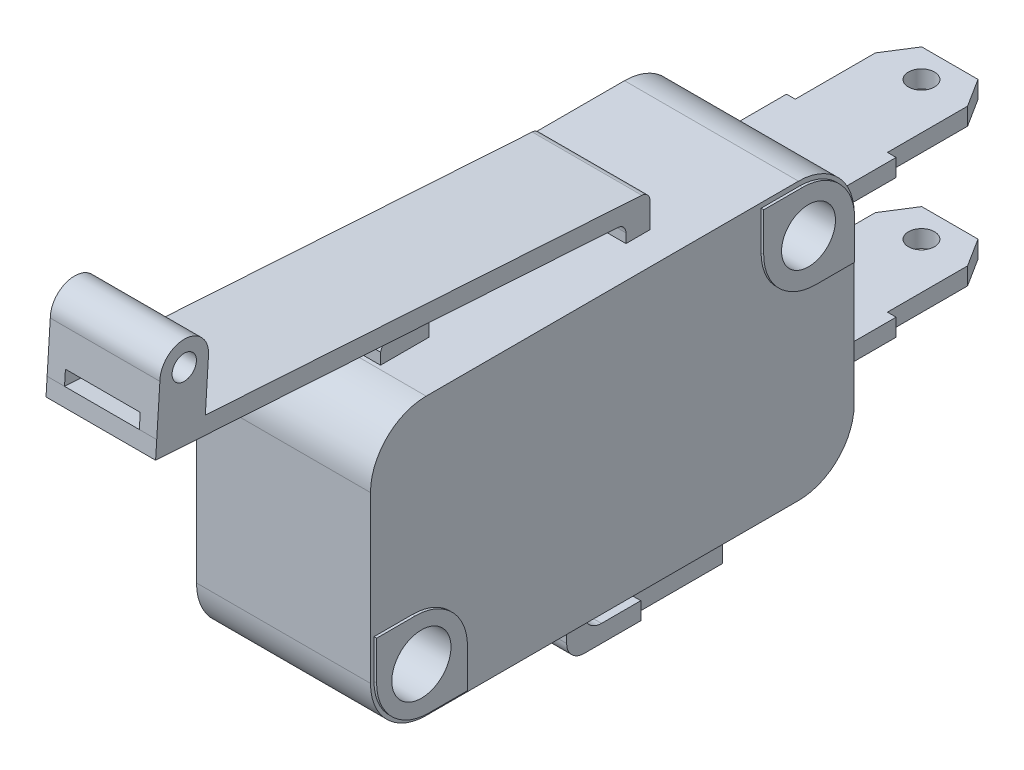
from build123d import *
from OCP.BRepFilletAPI import BRepFilletAPI_MakeChamfer

# Parameters (mm, degrees)
BOSS_EXTRUDE1_DEPTH        = 4.3
BOSS_EXTRUDE2_DEPTH        = 1
BOSS_EXTRUDE3_START        = 1
BOSS_EXTRUDE3_DEPTH        = 1
CUT_EXTRUDE1_DEPTH         = 4.3
SKETCH5_W                  = 1.380694599
SKETCH5_H                  = 0.913887033
BOSS_EXTRUDE4_DEPTH        = 1.85
SKETCH6_W                  = 8.15
SKETCH6_H                  = 1.380694599
BOSS_EXTRUDE5_DEPTH        = 16.905731032
SKETCH7_W                  = 8.15
SKETCH7_H                  = 17.819618065
BOSS_EXTRUDE6_DEPTH        = 9.886282081
CUT_EXTRUDE2_DEPTH         = 0.913887033
CUT_EXTRUDE3_DEPTH         = 1.005731032
SKETCH10_W                 = 8.15
SKETCH10_H                 = 15.9
BOSS_EXTRUDE7_DEPTH        = 16.53302332
SKETCH11_W                 = 27.8
SKETCH11_H                 = 15.9
BOSS_EXTRUDE8_DEPTH        = 1.85
SKETCH12_W                 = 6.3
SKETCH12_H                 = 1
BOSS_EXTRUDE9_DEPTH        = 3.3
SKETCH13_W                 = 6.3
SKETCH13_H                 = 1
BOSS_EXTRUDE10_DEPTH       = 9.5
SKETCH14_W                 = 0.5
SKETCH14_H                 = 6.238763167
CUT_EXTRUDE4_DEPTH         = 37.103920655
SKETCH15_W                 = 0.5
SKETCH15_H                 = 6.238763167
CUT_EXTRUDE5_DEPTH         = 37.103920655
SKETCH16_W                 = 6.3
SKETCH16_H                 = 1
BOSS_EXTRUDE11_DEPTH       = 10.5
SKETCH17_W                 = 0.5
SKETCH17_H                 = 6.238763167
CUT_EXTRUDE6_DEPTH         = 29.934160174
SKETCH18_W                 = 0.5
SKETCH18_H                 = 6.238763167
CUT_EXTRUDE7_DEPTH         = 29.934160174
SKETCH19_W                 = 6.3
SKETCH19_H                 = 1
BOSS_EXTRUDE12_DEPTH       = 10.5
SKETCH20_W                 = 0.5
SKETCH20_H                 = 6.238763167
CUT_EXTRUDE8_DEPTH         = 33.170848621
SKETCH21_W                 = 0.5
SKETCH21_H                 = 6.238763167
CUT_EXTRUDE9_DEPTH         = 33.170848621
SKETCH22_W                 = 5.225
SKETCH22_H                 = 5.225
BOSS_EXTRUDE13_DEPTH       = 0.15
SKETCH23_W                 = 5.225
SKETCH23_H                 = 5.225
BOSS_EXTRUDE14_DEPTH       = 0.15
BOSS_EXTRUDE15_DEPTH       = 4.3
SKETCH25_W                 = 5.225
SKETCH25_H                 = 5.225
BOSS_EXTRUDE16_DEPTH       = 0.15
SKETCH26_W                 = 5.225
SKETCH26_H                 = 5.225
BOSS_EXTRUDE17_DEPTH       = 0.15
F_00_CLEARANCE_HOLE1_D     = 1.5
F_00_CLEARANCE_HOLE1_DEPTH = 1
F_00_CLEARANCE_HOLE2_D     = 1.5
F_00_CLEARANCE_HOLE2_DEPTH = 15.725
F_4_CLEARANCE_HOLE1_D      = 3.1
F_4_CLEARANCE_HOLE2_D      = 3.4
F_00_CLEARANCE_HOLE3_D     = 1.5
F_00_CLEARANCE_HOLE3_DEPTH = 1
F_00_CLEARANCE_HOLE4_D     = 1.4
F_00_CLEARANCE_HOLE4_DEPTH = 1
F_00_CLEARANCE_HOLE5_D     = 1.4
F_00_CLEARANCE_HOLE5_DEPTH = 1
CHAMFER1_SIZE              = 1.632857048
CHAMFER1_SIZE2             = 1.033032958
CHAMFER2_SIZE              = 1.033032958
CHAMFER2_SIZE2             = 1.632857048
CHAMFER3_SIZE              = 1.632857048
CHAMFER3_SIZE2             = 1.033032958
FILLET1_R                  = 0.5
FILLET2_R                  = 1
FILLET3_R                  = 3
FILLET4_R                  = 3.2


with BuildPart() as part:
    # Sketch1 → Boss-Extrude1 (new body)
    with BuildSketch(Plane(origin=(2.15, 0, 0), x_dir=(0, 0, -1), z_dir=(1, 0, 0))):
        with BuildLine():
            Line((2.63302332, 8.955731032), (4.013717919, 8.955731032))
            Line((4.013717919, 8.955731032), (4.013717919, 9.869618065))
            Line((4.013717919, 9.869618065), (-21.541974901, 11.501192936))
            Line((-21.541974901, 11.501192936), (-21.354211514, 14.486814776))
            ThreePointArc((-21.354211514, 14.486814776), (-22.754211514, 15.886814776), (-24.154211514, 14.486814776))
            Line((-24.154211514, 14.486814776), (-24.336285828, 11.679592619))
            Line((-24.336285828, 11.679592619), (-24.4, 10.681624431))
            Line((-24.4, 10.681624431), (2.63302332, 8.955731032))
        make_face()
    extrude(amount=-BOSS_EXTRUDE1_DEPTH)

    # Sketch2 → Boss-Extrude2 (add)
    with BuildSketch(Plane.ZY.offset(2.15)):
        with BuildLine():
            Line((-2.63302332, 8.955731032), (-4.013717919, 8.955731032))
            Line((-4.013717919, 8.955731032), (-4.013717919, 9.869618065))
            Line((-4.013717919, 9.869618065), (21.541974901, 11.501192936))
            Line((21.541974901, 11.501192936), (21.354211514, 14.486814776))
            ThreePointArc((21.354211514, 14.486814776), (22.754211514, 15.886814776), (24.154211514, 14.486814776))
            Line((24.154211514, 14.486814776), (24.336285828, 11.679592619))
            Line((24.336285828, 11.679592619), (24.4, 10.681624431))
            Line((24.4, 10.681624431), (-2.63302332, 8.955731032))
        make_face()
    extrude(amount=BOSS_EXTRUDE2_DEPTH)

    # Sketch3 → Boss-Extrude3 (add)
    with BuildSketch(Plane(origin=(2.15, 0, 0), x_dir=(0, 0, -1), z_dir=(1, 0, 0)).offset(BOSS_EXTRUDE3_START)):
        with BuildLine():
            Line((4.013717919, 8.955731032), (2.63302332, 8.955731032))
            Line((2.63302332, 8.955731032), (-24.4, 10.681624431))
            Line((-24.4, 10.681624431), (-24.336285828, 11.679592619))
            Line((-24.336285828, 11.679592619), (-24.154211514, 14.486814776))
            ThreePointArc((-24.154211514, 14.486814776), (-22.754211514, 15.886814776), (-21.354211514, 14.486814776))
            Line((-21.354211514, 14.486814776), (-21.541974901, 11.501192936))
            Line((-21.541974901, 11.501192936), (4.013717919, 9.869618065))
            Line((4.013717919, 9.869618065), (4.013717919, 8.955731032))
        make_face()
    extrude(amount=-BOSS_EXTRUDE3_DEPTH)

    # Sketch4 → Cut-Extrude1 (cut)
    with BuildSketch(Plane(origin=(2.15, 0, 0), x_dir=(0, 0, -1), z_dir=(1, 0, 0))):
        with BuildLine():
            Line((-24.28253184, 12.508371707), (-24.336285828, 11.679592619))
            Line((-24.336285828, 11.679592619), (-21.541974901, 11.501192936))
            Line((-21.541974901, 11.501192936), (-21.489844991, 12.330109582))
            ThreePointArc((-21.489844991, 12.330109582), (-22.913466809, 11.991892383), (-24.28253184, 12.508371707))
        make_face()
    extrude(amount=-CUT_EXTRUDE1_DEPTH, mode=Mode.SUBTRACT)

    # Sketch5 → Boss-Extrude4 (add)
    with BuildSketch(Plane.ZY.offset(3.15)):
        with Locations((-3.32337062, 9.412674549)):
            Rectangle(SKETCH5_W, SKETCH5_H)
    extrude(amount=BOSS_EXTRUDE4_DEPTH)

    # Sketch6 → Boss-Extrude5 (add)
    with BuildSketch(Plane.XZ.offset(-8.955731032)):
        with Locations((-0.925, -3.32337062)):
            Rectangle(SKETCH6_W, SKETCH6_H)
    extrude(amount=BOSS_EXTRUDE5_DEPTH)

    # Sketch7 → Boss-Extrude6 (add)
    with BuildSketch(Plane(origin=(0, 0, -4.013717919), x_dir=(-1, 0, 0), z_dir=(0, 0, -1))):
        with Locations((0.925, 0.959809033)):
            Rectangle(SKETCH7_W, SKETCH7_H)
    extrude(amount=BOSS_EXTRUDE6_DEPTH)

    # Sketch8 → Cut-Extrude2 (cut)
    with BuildSketch(Plane(origin=(0, 9.869618065, 0), x_dir=(-1, 0, 0), z_dir=(0, 1, 0))):
        Polygon((5, -13.9), (5, -2.63302332), (3.15, -2.63302332), (3.15, -4.013717919), (-3.15, -4.013717919), (-3.15, -13.9), align=None)
    extrude(amount=-CUT_EXTRUDE2_DEPTH, mode=Mode.SUBTRACT)

    # Sketch9 → Cut-Extrude3 (cut)
    with BuildSketch(Plane(origin=(0, 8.955731032, 0), x_dir=(-1, 0, 0), z_dir=(0, 1, 0))):
        Polygon((5, -13.9), (5, -2.63302332), (3.15, -2.63302332), (3.15, -4.013717919), (-3.15, -4.013717919), (-3.15, -13.9), align=None)
    extrude(amount=-CUT_EXTRUDE3_DEPTH, mode=Mode.SUBTRACT)

    # Sketch10 → Boss-Extrude7 (add)
    with BuildSketch(Plane.XY.offset(-2.63302332)):
        with Locations((-0.925, 0)):
            Rectangle(SKETCH10_W, SKETCH10_H)
    extrude(amount=BOSS_EXTRUDE7_DEPTH)

    # Sketch11 → Boss-Extrude8 (add)
    with BuildSketch(Plane(origin=(3.15, 0, 0), x_dir=(0, 0, -1), z_dir=(1, 0, 0))):
        Rectangle(SKETCH11_W, SKETCH11_H)
    extrude(amount=BOSS_EXTRUDE8_DEPTH)

    # Sketch12 → Boss-Extrude9 (add)
    with BuildSketch(Plane.XZ.offset(7.95)):
        with Locations((0, 0.275)):
            Rectangle(SKETCH12_W, SKETCH12_H)
    extrude(amount=BOSS_EXTRUDE9_DEPTH)

    # Sketch13 → Boss-Extrude10 (add)
    with BuildSketch(Plane(origin=(0, 0, -0.225), x_dir=(-1, 0, 0), z_dir=(0, 0, -1))):
        with Locations((0, -10.75)):
            Rectangle(SKETCH13_W, SKETCH13_H)
    extrude(amount=BOSS_EXTRUDE10_DEPTH)

    # Sketch14 → Cut-Extrude4 (cut, through all)
    with BuildSketch(Plane(origin=(0, -10.25, 0), x_dir=(-1, 0, 0), z_dir=(0, 1, 0))):
        with Locations((2.9, -6.605618417)):
            Rectangle(SKETCH14_W, SKETCH14_H)
    extrude(amount=-CUT_EXTRUDE4_DEPTH, mode=Mode.SUBTRACT)

    # Sketch15 → Cut-Extrude5 (cut, through all)
    with BuildSketch(Plane(origin=(0, -10.25, 0), x_dir=(-1, 0, 0), z_dir=(0, 1, 0))):
        with Locations((-2.9, -6.605618417)):
            Rectangle(SKETCH15_W, SKETCH15_H)
    extrude(amount=-CUT_EXTRUDE5_DEPTH, mode=Mode.SUBTRACT)

    # Sketch16 → Boss-Extrude11 (add)
    with BuildSketch(Plane(origin=(0, 0, -13.9), x_dir=(-1, 0, 0), z_dir=(0, 0, -1))):
        with Locations((0, 3.975)):
            Rectangle(SKETCH16_W, SKETCH16_H)
    extrude(amount=BOSS_EXTRUDE11_DEPTH)

    # Sketch17 → Cut-Extrude6 (cut, through all)
    with BuildSketch(Plane.XZ.offset(-3.475)):
        with Locations((2.9, -21.280618417)):
            Rectangle(SKETCH17_W, SKETCH17_H)
    extrude(amount=-CUT_EXTRUDE6_DEPTH, mode=Mode.SUBTRACT)

    # Sketch18 → Cut-Extrude7 (cut, through all)
    with BuildSketch(Plane.XZ.offset(-3.475)):
        with Locations((-2.9, -21.280618417)):
            Rectangle(SKETCH18_W, SKETCH18_H)
    extrude(amount=-CUT_EXTRUDE7_DEPTH, mode=Mode.SUBTRACT)

    # Sketch19 → Boss-Extrude12 (add)
    with BuildSketch(Plane(origin=(0, 0, -13.9), x_dir=(-1, 0, 0), z_dir=(0, 0, -1))):
        with Locations((0, -3.975)):
            Rectangle(SKETCH19_W, SKETCH19_H)
    extrude(amount=BOSS_EXTRUDE12_DEPTH)

    # Sketch20 → Cut-Extrude8 (cut, through all)
    with BuildSketch(Plane.XZ.offset(4.475)):
        with Locations((2.9, -21.280618417)):
            Rectangle(SKETCH20_W, SKETCH20_H)
    extrude(amount=-CUT_EXTRUDE8_DEPTH, mode=Mode.SUBTRACT)

    # Sketch21 → Cut-Extrude9 (cut, through all)
    with BuildSketch(Plane.XZ.offset(4.475)):
        with Locations((-2.9, -21.280618417)):
            Rectangle(SKETCH21_W, SKETCH21_H)
    extrude(amount=-CUT_EXTRUDE9_DEPTH, mode=Mode.SUBTRACT)

    # Sketch22 → Boss-Extrude13 (add)
    with BuildSketch(Plane.ZY.offset(5)):
        with Locations((-11.1625, 5.0625)):
            Rectangle(SKETCH22_W, SKETCH22_H)
    extrude(amount=BOSS_EXTRUDE13_DEPTH)

    # Sketch23 → Boss-Extrude14 (add)
    with BuildSketch(Plane.ZY.offset(5)):
        with Locations((11.0875, -5.1375)):
            Rectangle(SKETCH23_W, SKETCH23_H)
    extrude(amount=BOSS_EXTRUDE14_DEPTH)

    # Sketch24 → Boss-Extrude15 (add)
    with BuildSketch(Plane(origin=(-2.15, 0, 0), x_dir=(0, -1, 0), z_dir=(-1, 0, 0))):
        with BuildLine():
            Line((-8.6, 7.675), (-7.95, 7.675))
            Line((-7.95, 7.675), (-7.95, 10.475))
            Line((-7.95, 10.475), (-8.6, 10.475))
            ThreePointArc((-8.6, 10.475), (-9.6, 9.075), (-8.6, 7.675))
        make_face()
    extrude(amount=-BOSS_EXTRUDE15_DEPTH)

    # Sketch25 → Boss-Extrude16 (add)
    with BuildSketch(Plane(origin=(5, 0, 0), x_dir=(0, 0, -1), z_dir=(1, 0, 0))):
        with Locations((-11.0875, -5.1375)):
            Rectangle(SKETCH25_W, SKETCH25_H)
    extrude(amount=BOSS_EXTRUDE16_DEPTH)

    # Sketch26 → Boss-Extrude17 (add)
    with BuildSketch(Plane(origin=(5, 0, 0), x_dir=(0, 0, -1), z_dir=(1, 0, 0))):
        with Locations((11.1625, 5.0625)):
            Rectangle(SKETCH26_W, SKETCH26_H)
    extrude(amount=BOSS_EXTRUDE17_DEPTH)

    # #00 Clearance Hole1
    with Locations(Plane(origin=(0, -4.475, 0), x_dir=(-1, 0, 0), z_dir=(0, -1, 0))):
        with Locations((0, 22.767142952)):
            Hole(F_00_CLEARANCE_HOLE1_D / 2, depth=F_00_CLEARANCE_HOLE1_DEPTH)

    # #00 Clearance Hole2
    with Locations(Plane(origin=(0, 4.475, 0), x_dir=(1, 0, 0), z_dir=(0, 1, 0))):
        with Locations((0, 22.767142952)):
            Hole(F_00_CLEARANCE_HOLE2_D / 2, depth=F_00_CLEARANCE_HOLE2_DEPTH)

    # #4 Clearance Hole1 (through all)
    with Locations(Plane(origin=(5.15, 0, 0), x_dir=(0, 0, -1), z_dir=(1, 0, 0))):
        with Locations((11.125, 5.1)):
            Hole(F_4_CLEARANCE_HOLE1_D / 2)

    # #4 Clearance Hole2 (through all)
    with Locations(Plane(origin=(5.15, 0, 0), x_dir=(0, 0, -1), z_dir=(1, 0, 0))):
        with Locations((-11.125, -5.1)):
            Hole(F_4_CLEARANCE_HOLE2_D / 2)

    # #00 Clearance Hole3
    with Locations(Plane(origin=(0, -10.25, 0), x_dir=(1, 0, 0), z_dir=(0, 1, 0))):
        with Locations((0, 8.092142952)):
            Hole(F_00_CLEARANCE_HOLE3_D / 2, depth=F_00_CLEARANCE_HOLE3_DEPTH)

    # #00 Clearance Hole4
    with Locations(Plane(origin=(3.15, 0, 0), x_dir=(0, 0, -1), z_dir=(1, 0, 0))):
        with Locations((-22.754211514, 14.486814776)):
            Hole(F_00_CLEARANCE_HOLE4_D / 2, depth=F_00_CLEARANCE_HOLE4_DEPTH)

    # #00 Clearance Hole5
    with Locations(Plane.ZY.offset(3.15)):
        with Locations((22.754211514, 14.486814776)):
            Hole(F_00_CLEARANCE_HOLE5_D / 2, depth=F_00_CLEARANCE_HOLE5_DEPTH)

    # Chamfer1: one chamfer whose edges measure the first distance from different faces: ONE call of the kernel's chamfer builder (chamfer() names one face for all edges)
    chamfer1_edges_1 = [part.edges().sort_by_distance(p)[0] for p in [
        (-2.65, 3.975, -24.4),
    ]]
    chamfer1_side_1 = [part.faces().sort_by_distance(p)[0] for p in [
        (-2.65, 3.975, -21.280618417),
    ]]
    chamfer1_edges_2 = [part.edges().sort_by_distance(p)[0] for p in [
        (-2.65, -3.975, -24.4),
    ]]
    chamfer1_side_2 = [part.faces().sort_by_distance(p)[0] for p in [
        (-2.65, -3.975, -21.280618417),
    ]]
    chamfer1 = BRepFilletAPI_MakeChamfer(part.part.solid().wrapped)
    for e in chamfer1_edges_1:
        chamfer1.Add(CHAMFER1_SIZE, CHAMFER1_SIZE2, e.wrapped, chamfer1_side_1[0].wrapped)  # the first distance lies on this face
    for e in chamfer1_edges_2:
        chamfer1.Add(CHAMFER1_SIZE, CHAMFER1_SIZE2, e.wrapped, chamfer1_side_2[0].wrapped)  # the first distance lies on this face
    add(Compound.cast(chamfer1.Shape()), mode=Mode.REPLACE)

    # Chamfer2: one chamfer whose edges measure the first distance from different faces: ONE call of the kernel's chamfer builder (chamfer() names one face for all edges)
    chamfer2_edges_1 = [part.edges().sort_by_distance(p)[0] for p in [
        (2.65, 3.975, -24.4),
    ]]
    chamfer2_side_1 = [part.faces().sort_by_distance(p)[0] for p in [
        (0.516516479, 3.975, -24.4),
    ]]
    chamfer2_edges_2 = [part.edges().sort_by_distance(p)[0] for p in [
        (2.65, -3.975, -24.4),
    ]]
    chamfer2_side_2 = [part.faces().sort_by_distance(p)[0] for p in [
        (0.516516479, -3.975, -24.4),
    ]]
    chamfer2 = BRepFilletAPI_MakeChamfer(part.part.solid().wrapped)
    for e in chamfer2_edges_1:
        chamfer2.Add(CHAMFER2_SIZE, CHAMFER2_SIZE2, e.wrapped, chamfer2_side_1[0].wrapped)  # the first distance lies on this face
    for e in chamfer2_edges_2:
        chamfer2.Add(CHAMFER2_SIZE, CHAMFER2_SIZE2, e.wrapped, chamfer2_side_2[0].wrapped)  # the first distance lies on this face
    add(Compound.cast(chamfer2.Shape()), mode=Mode.REPLACE)

    # Chamfer3: one chamfer whose edges measure the first distance from different faces: ONE call of the kernel's chamfer builder (chamfer() names one face for all edges)
    chamfer3_edges_1 = [part.edges().sort_by_distance(p)[0] for p in [
        (-2.65, -10.75, -9.725),
    ]]
    chamfer3_side_1 = [part.faces().sort_by_distance(p)[0] for p in [
        (-2.65, -10.75, -6.605618417),
    ]]
    chamfer3_edges_2 = [part.edges().sort_by_distance(p)[0] for p in [
        (2.65, -10.75, -9.725),
    ]]
    chamfer3_side_2 = [part.faces().sort_by_distance(p)[0] for p in [
        (0, -10.75, -9.725),
    ]]
    chamfer3 = BRepFilletAPI_MakeChamfer(part.part.solid().wrapped)
    for e in chamfer3_edges_1:
        chamfer3.Add(CHAMFER3_SIZE, CHAMFER3_SIZE2, e.wrapped, chamfer3_side_1[0].wrapped)  # the first distance lies on this face
    for e in chamfer3_edges_2:
        chamfer3.Add(CHAMFER3_SIZE, CHAMFER3_SIZE2, e.wrapped, chamfer3_side_2[0].wrapped)  # the first distance lies on this face
    add(Compound.cast(chamfer3.Shape()), mode=Mode.REPLACE)

    # Fillet1
    fillet1_edges = [part.edges().sort_by_distance(p)[0] for p in [
        (0, 9.869618065, -4.013717919),
        (0, 8.955731032, -2.63302332),
    ]]
    fillet(fillet1_edges, radius=FILLET1_R)

    # Fillet2
    fillet2_edges = [part.edges().sort_by_distance(p)[0] for p in [
        (0, -11.25, 0.775),
        (0, -10.25, -0.225),
    ]]
    fillet(fillet2_edges, radius=FILLET2_R)

    # Fillet3
    fillet3_edges = [part.edges().sort_by_distance(p)[0] for p in [
        (-5.075, 2.45, -8.55),
        (-5.075, 7.675, -13.775),
        (-5.075, -7.75, 13.7),
        (-5.075, -2.525, 8.475),
        (5.075, -7.75, 13.7),
        (5.075, -2.525, 8.475),
        (5.075, 2.45, -8.55),
        (5.075, 7.675, -13.775),
    ]]
    fillet(fillet3_edges, radius=FILLET3_R)

    # Fillet4
    fillet4_edges = [part.edges().sort_by_distance(p)[0] for p in [
        (0, -7.95, -13.9),
        (0, 7.95, -13.9),
        (0, 7.95, 13.9),
        (0, -7.95, 13.9),
    ]]
    fillet(fillet4_edges, radius=FILLET4_R)


solid = part.part
